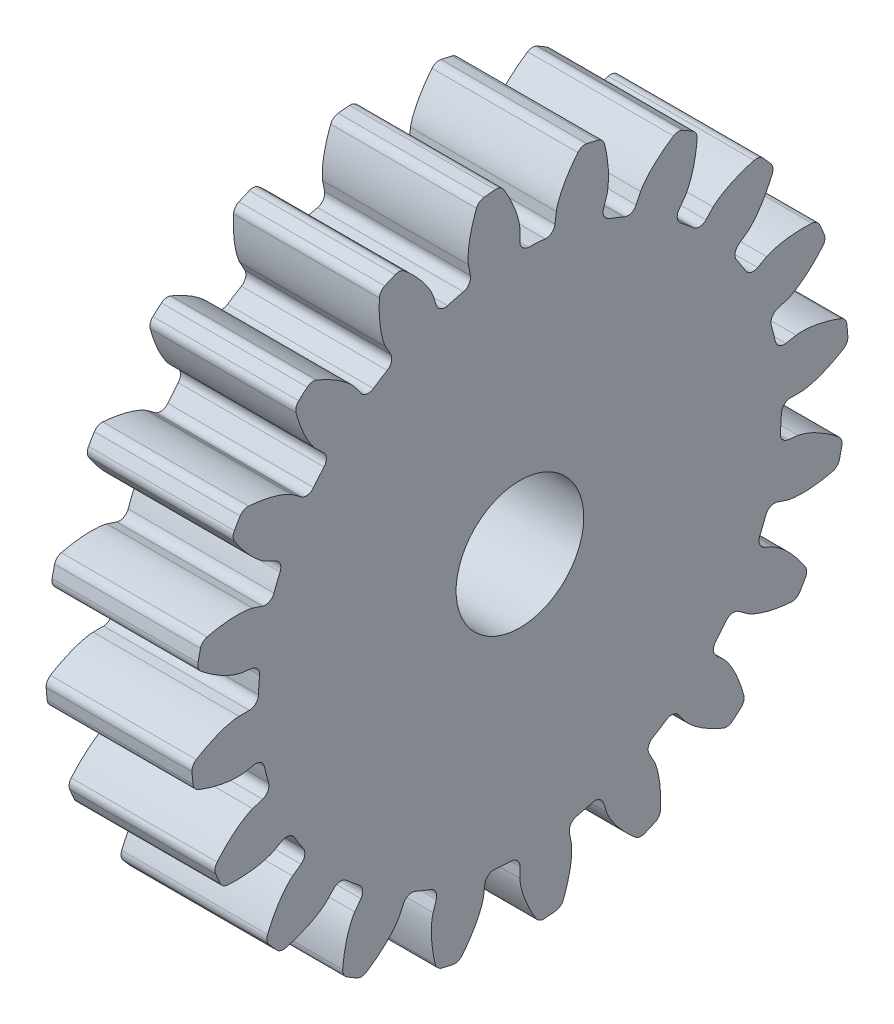
from build123d import *

# Parameters (mm, degrees)
SKETCH2_R                 = 9.02
SKETCH2_R_2               = 1.75
BOSS_EXTRUDE1_DEPTH       = 2
CUT_EXTRUDE1_DEPTH        = 14.368649894
CIRPATTERN9_COUNT         = 20
CIRPATTERN9_COPY_1_DEPTH  = 14.368649894
CIRPATTERN9_COPY_2_DEPTH  = 14.368649894
CIRPATTERN9_COPY_3_DEPTH  = 14.368649894
CIRPATTERN9_COPY_4_DEPTH  = 14.368649894
CIRPATTERN9_COPY_5_DEPTH  = 14.368649894
CIRPATTERN9_COPY_6_DEPTH  = 14.368649894
CIRPATTERN9_COPY_7_DEPTH  = 14.368649894
CIRPATTERN9_COPY_8_DEPTH  = 14.368649894
CIRPATTERN9_COPY_9_DEPTH  = 14.368649894
CIRPATTERN9_COPY_10_DEPTH = 14.368649894
CIRPATTERN9_COPY_11_DEPTH = 14.368649894
CIRPATTERN9_COPY_12_DEPTH = 14.368649894
CIRPATTERN9_COPY_13_DEPTH = 14.368649894
CIRPATTERN9_COPY_14_DEPTH = 14.368649894
CIRPATTERN9_COPY_15_DEPTH = 14.368649894
CIRPATTERN9_COPY_16_DEPTH = 14.368649894
CIRPATTERN9_COPY_17_DEPTH = 14.368649894
CIRPATTERN9_COPY_18_DEPTH = 14.368649894
CIRPATTERN9_COPY_19_DEPTH = 14.368649894
FILLET7_R                 = 0.25


with BuildPart() as part:
    # Sketch2 → Boss-Extrude1 (new, symmetric)
    with BuildSketch(Plane(origin=(0, 0, 0), x_dir=(0, -1, 0), z_dir=(1, 0, 0))):
        with Locations(Location((0, 0, 0), (0, 0, 90))):
            Circle(SKETCH2_R)
        with Locations(Location((0, 0, 0), (0, 0, 90))):
            Circle(SKETCH2_R_2, mode=Mode.SUBTRACT)
    extrude(amount=BOSS_EXTRUDE1_DEPTH, both=True)

    # Sketch3 → Cut-Extrude1 (cut, through all)
    with BuildSketch(Plane(origin=(2, 0, 0), x_dir=(0, 0, -1), z_dir=(1, 0, 0))):
        with BuildLine():
            add(Edge.make_bspline(
                [(-8.199249819, -0.110916186), (-8.226192263, -0.120506478), (-8.280187666, -0.14055911), (-8.360557059, -0.172783854), (-8.466275894, -0.219646883), (-8.57068504, -0.270055502), (-8.695529138, -0.335265376), (-8.817281381, -0.404615455), (-8.912062125, -0.463167601), (-8.981016575, -0.508033396), (-9.004780278, -0.523767261)],
                knots=[0.119851252, 0.119851252, 0.119851252, 0.119851252, 0.119851252, 0.146842495, 0.174208853, 0.201574955, 0.228941013, 0.256307345, 0.307035032, 0.333940628, 0.333940628, 0.333940628, 0.333940628, 0.333940628], degree=4))
            ThreePointArc((-8.199249819, -0.110916186), (-8.197283044, 0.211070364), (-8.182676652, 0.532731458))
            Line((-8.182676652, 0.532731458), (-9.000944317, 0.586004604))
            ThreePointArc((-9.000944317, 0.586004604), (-9.019946117, 0.031177722), (-9.004780278, -0.523767261))
        make_face()
        with BuildLine():
            Line((-7.70547949, 0), (-7.175, 0))
            ThreePointArc((-7.175, 0), (-7.171209516, 0.233193207), (-7.159842071, 0.466140026))
            Line((-7.159842071, 0.466140026), (-8.182676652, 0.532731458))
            ThreePointArc((-8.182676652, 0.532731458), (-8.197283044, 0.211070364), (-8.199249819, -0.110916186))
            add(Edge.make_bspline(
                [(-7.70547949, 0), (-7.711177451, 0), (-7.727154283, -0.000373244), (-7.757323749, -0.00255245), (-7.806393921, -0.00819623), (-7.868603495, -0.0184454), (-7.948497449, -0.035184494), (-8.041814695, -0.059365089), (-8.116007906, -0.082170078), (-8.171182976, -0.100931564), (-8.19887542, -0.110782917), (-8.199249819, -0.110916186)],
                knots=[0, 0, 0, 0, 0, 0.005376748, 0.015083688, 0.02853182, 0.046610139, 0.064854849, 0.092110525, 0.119476175, 0.119851252, 0.119851252, 0.119851252, 0.119851252, 0.119851252], degree=4))
        make_face()
    cut_extrude1 = extrude(amount=-CUT_EXTRUDE1_DEPTH, mode=Mode.SUBTRACT)

    # Mirror2: Cut-Extrude1 across plane
    add(cut_extrude1.mirror(Plane(origin=(0, 0, 0), x_dir=(0, 0.06496725101494437, 0.9978873966012204), z_dir=(0, 0.9978873966012204, -0.06496725101494437))), mode=Mode.SUBTRACT)

    # CirPattern9: Cut-Extrude1 ×20 about axis
    cirpattern9_axis = Axis((88.99, 0, 0), (-1, 0, 0))
    for i in range(1, CIRPATTERN9_COUNT):
        add(cut_extrude1.rotate(cirpattern9_axis, i * 360 / CIRPATTERN9_COUNT), mode=Mode.SUBTRACT)

    # CirPattern9 copy 1 sketch → CirPattern9 copy 1 (cut, through all)
    with BuildSketch(Plane(origin=(2, 0, 0), x_dir=(0, -0.42972242107401926, -0.90296104059161), z_dir=(1, 0, 0))):
        with BuildLine():
            add(Edge.make_bspline(
                [(-8.199249819, 0.110916186), (-8.226192263, 0.120506478), (-8.280187666, 0.14055911), (-8.360557059, 0.172783854), (-8.466275894, 0.219646883), (-8.57068504, 0.270055502), (-8.695529138, 0.335265376), (-8.817281381, 0.404615455), (-8.912062125, 0.463167601), (-8.981016575, 0.508033396), (-9.004780278, 0.523767261)],
                knots=[0.119851252, 0.119851252, 0.119851252, 0.119851252, 0.119851252, 0.146842495, 0.174208853, 0.201574955, 0.228941013, 0.256307345, 0.307035032, 0.333940628, 0.333940628, 0.333940628, 0.333940628, 0.333940628], degree=4))
            ThreePointArc((-8.199249819, 0.110916186), (-8.197283044, -0.211070364), (-8.182676652, -0.532731458))
            Line((-8.182676652, -0.532731458), (-9.000944317, -0.586004604))
            ThreePointArc((-9.000944317, -0.586004604), (-9.019946117, -0.031177722), (-9.004780278, 0.523767261))
        make_face()
        with BuildLine():
            Line((-7.70547949, 0), (-7.175, 0))
            ThreePointArc((-7.175, 0), (-7.171209516, -0.233193207), (-7.159842071, -0.466140026))
            Line((-7.159842071, -0.466140026), (-8.182676652, -0.532731458))
            ThreePointArc((-8.182676652, -0.532731458), (-8.197283044, -0.211070364), (-8.199249819, 0.110916186))
            add(Edge.make_bspline(
                [(-7.70547949, 0), (-7.711177451, 0), (-7.727154283, 0.000373244), (-7.757323749, 0.00255245), (-7.806393921, 0.00819623), (-7.868603495, 0.0184454), (-7.948497449, 0.035184494), (-8.041814695, 0.059365089), (-8.116007906, 0.082170078), (-8.171182976, 0.100931564), (-8.19887542, 0.110782917), (-8.199249819, 0.110916186)],
                knots=[0, 0, 0, 0, 0, 0.005376748, 0.015083688, 0.02853182, 0.046610139, 0.064854849, 0.092110525, 0.119476175, 0.119851252, 0.119851252, 0.119851252, 0.119851252, 0.119851252], degree=4))
        make_face()
    extrude(amount=-CIRPATTERN9_COPY_1_DEPTH, mode=Mode.SUBTRACT)

    # CirPattern9 copy 2 sketch → CirPattern9 copy 2 (cut, through all)
    with BuildSketch(Plane(origin=(2, 0, 0), x_dir=(0, -0.6877206155618701, -0.7259754506394844), z_dir=(1, 0, 0))):
        with BuildLine():
            add(Edge.make_bspline(
                [(-8.199249819, 0.110916186), (-8.226192263, 0.120506478), (-8.280187666, 0.14055911), (-8.360557059, 0.172783854), (-8.466275894, 0.219646883), (-8.57068504, 0.270055502), (-8.695529138, 0.335265376), (-8.817281381, 0.404615455), (-8.912062125, 0.463167601), (-8.981016575, 0.508033396), (-9.004780278, 0.523767261)],
                knots=[0.119851252, 0.119851252, 0.119851252, 0.119851252, 0.119851252, 0.146842495, 0.174208853, 0.201574955, 0.228941013, 0.256307345, 0.307035032, 0.333940628, 0.333940628, 0.333940628, 0.333940628, 0.333940628], degree=4))
            ThreePointArc((-8.199249819, 0.110916186), (-8.197283044, -0.211070364), (-8.182676652, -0.532731458))
            Line((-8.182676652, -0.532731458), (-9.000944317, -0.586004604))
            ThreePointArc((-9.000944317, -0.586004604), (-9.019946117, -0.031177722), (-9.004780278, 0.523767261))
        make_face()
        with BuildLine():
            Line((-7.70547949, 0), (-7.175, 0))
            ThreePointArc((-7.175, 0), (-7.171209516, -0.233193207), (-7.159842071, -0.466140026))
            Line((-7.159842071, -0.466140026), (-8.182676652, -0.532731458))
            ThreePointArc((-8.182676652, -0.532731458), (-8.197283044, -0.211070364), (-8.199249819, 0.110916186))
            add(Edge.make_bspline(
                [(-7.70547949, 0), (-7.711177451, 0), (-7.727154283, 0.000373244), (-7.757323749, 0.00255245), (-7.806393921, 0.00819623), (-7.868603495, 0.0184454), (-7.948497449, 0.035184494), (-8.041814695, 0.059365089), (-8.116007906, 0.082170078), (-8.171182976, 0.100931564), (-8.19887542, 0.110782917), (-8.199249819, 0.110916186)],
                knots=[0, 0, 0, 0, 0, 0.005376748, 0.015083688, 0.02853182, 0.046610139, 0.064854849, 0.092110525, 0.119476175, 0.119851252, 0.119851252, 0.119851252, 0.119851252, 0.119851252], degree=4))
        make_face()
    extrude(amount=-CIRPATTERN9_COPY_2_DEPTH, mode=Mode.SUBTRACT)

    # CirPattern9 copy 3 sketch → CirPattern9 copy 3 (cut, through all)
    with BuildSketch(Plane(origin=(2, 0, 0), x_dir=(0, -0.8783999245672423, -0.47792632541037444), z_dir=(1, 0, 0))):
        with BuildLine():
            add(Edge.make_bspline(
                [(-8.199249819, 0.110916186), (-8.226192263, 0.120506478), (-8.280187666, 0.14055911), (-8.360557059, 0.172783854), (-8.466275894, 0.219646883), (-8.57068504, 0.270055502), (-8.695529138, 0.335265376), (-8.817281381, 0.404615455), (-8.912062125, 0.463167601), (-8.981016575, 0.508033396), (-9.004780278, 0.523767261)],
                knots=[0.119851252, 0.119851252, 0.119851252, 0.119851252, 0.119851252, 0.146842495, 0.174208853, 0.201574955, 0.228941013, 0.256307345, 0.307035032, 0.333940628, 0.333940628, 0.333940628, 0.333940628, 0.333940628], degree=4))
            ThreePointArc((-8.199249819, 0.110916186), (-8.197283044, -0.211070364), (-8.182676652, -0.532731458))
            Line((-8.182676652, -0.532731458), (-9.000944317, -0.586004604))
            ThreePointArc((-9.000944317, -0.586004604), (-9.019946117, -0.031177722), (-9.004780278, 0.523767261))
        make_face()
        with BuildLine():
            Line((-7.70547949, 0), (-7.175, 0))
            ThreePointArc((-7.175, 0), (-7.171209516, -0.233193207), (-7.159842071, -0.466140026))
            Line((-7.159842071, -0.466140026), (-8.182676652, -0.532731458))
            ThreePointArc((-8.182676652, -0.532731458), (-8.197283044, -0.211070364), (-8.199249819, 0.110916186))
            add(Edge.make_bspline(
                [(-7.70547949, 0), (-7.711177451, 0), (-7.727154283, 0.000373244), (-7.757323749, 0.00255245), (-7.806393921, 0.00819623), (-7.868603495, 0.0184454), (-7.948497449, 0.035184494), (-8.041814695, 0.059365089), (-8.116007906, 0.082170078), (-8.171182976, 0.100931564), (-8.19887542, 0.110782917), (-8.199249819, 0.110916186)],
                knots=[0, 0, 0, 0, 0, 0.005376748, 0.015083688, 0.02853182, 0.046610139, 0.064854849, 0.092110525, 0.119476175, 0.119851252, 0.119851252, 0.119851252, 0.119851252, 0.119851252], degree=4))
        make_face()
    extrude(amount=-CIRPATTERN9_COPY_3_DEPTH, mode=Mode.SUBTRACT)

    # CirPattern9 copy 4 sketch → CirPattern9 copy 4 (cut, through all)
    with BuildSketch(Plane(origin=(2, 0, 0), x_dir=(0, -0.983095328783824, -0.1830944415415849), z_dir=(1, 0, 0))):
        with BuildLine():
            add(Edge.make_bspline(
                [(-8.199249819, 0.110916186), (-8.226192263, 0.120506478), (-8.280187666, 0.14055911), (-8.360557059, 0.172783854), (-8.466275894, 0.219646883), (-8.57068504, 0.270055502), (-8.695529138, 0.335265376), (-8.817281381, 0.404615455), (-8.912062125, 0.463167601), (-8.981016575, 0.508033396), (-9.004780278, 0.523767261)],
                knots=[0.119851252, 0.119851252, 0.119851252, 0.119851252, 0.119851252, 0.146842495, 0.174208853, 0.201574955, 0.228941013, 0.256307345, 0.307035032, 0.333940628, 0.333940628, 0.333940628, 0.333940628, 0.333940628], degree=4))
            ThreePointArc((-8.199249819, 0.110916186), (-8.197283044, -0.211070364), (-8.182676652, -0.532731458))
            Line((-8.182676652, -0.532731458), (-9.000944317, -0.586004604))
            ThreePointArc((-9.000944317, -0.586004604), (-9.019946117, -0.031177722), (-9.004780278, 0.523767261))
        make_face()
        with BuildLine():
            Line((-7.70547949, 0), (-7.175, 0))
            ThreePointArc((-7.175, 0), (-7.171209516, -0.233193207), (-7.159842071, -0.466140026))
            Line((-7.159842071, -0.466140026), (-8.182676652, -0.532731458))
            ThreePointArc((-8.182676652, -0.532731458), (-8.197283044, -0.211070364), (-8.199249819, 0.110916186))
            add(Edge.make_bspline(
                [(-7.70547949, 0), (-7.711177451, 0), (-7.727154283, 0.000373244), (-7.757323749, 0.00255245), (-7.806393921, 0.00819623), (-7.868603495, 0.0184454), (-7.948497449, 0.035184494), (-8.041814695, 0.059365089), (-8.116007906, 0.082170078), (-8.171182976, 0.100931564), (-8.19887542, 0.110782917), (-8.199249819, 0.110916186)],
                knots=[0, 0, 0, 0, 0, 0.005376748, 0.015083688, 0.02853182, 0.046610139, 0.064854849, 0.092110525, 0.119476175, 0.119851252, 0.119851252, 0.119851252, 0.119851252, 0.119851252], degree=4))
        make_face()
    extrude(amount=-CIRPATTERN9_COPY_4_DEPTH, mode=Mode.SUBTRACT)

    # CirPattern9 copy 5 sketch → CirPattern9 copy 5 (cut, through all)
    with BuildSketch(Plane(origin=(2, 0, 0), x_dir=(0, -0.9915585125911224, 0.1296600019592816), z_dir=(1, 0, 0))):
        with BuildLine():
            add(Edge.make_bspline(
                [(-8.199249819, 0.110916186), (-8.226192263, 0.120506478), (-8.280187666, 0.14055911), (-8.360557059, 0.172783854), (-8.466275894, 0.219646883), (-8.57068504, 0.270055502), (-8.695529138, 0.335265376), (-8.817281381, 0.404615455), (-8.912062125, 0.463167601), (-8.981016575, 0.508033396), (-9.004780278, 0.523767261)],
                knots=[0.119851252, 0.119851252, 0.119851252, 0.119851252, 0.119851252, 0.146842495, 0.174208853, 0.201574955, 0.228941013, 0.256307345, 0.307035032, 0.333940628, 0.333940628, 0.333940628, 0.333940628, 0.333940628], degree=4))
            ThreePointArc((-8.199249819, 0.110916186), (-8.197283044, -0.211070364), (-8.182676652, -0.532731458))
            Line((-8.182676652, -0.532731458), (-9.000944317, -0.586004604))
            ThreePointArc((-9.000944317, -0.586004604), (-9.019946117, -0.031177722), (-9.004780278, 0.523767261))
        make_face()
        with BuildLine():
            Line((-7.70547949, 0), (-7.175, 0))
            ThreePointArc((-7.175, 0), (-7.171209516, -0.233193207), (-7.159842071, -0.466140026))
            Line((-7.159842071, -0.466140026), (-8.182676652, -0.532731458))
            ThreePointArc((-8.182676652, -0.532731458), (-8.197283044, -0.211070364), (-8.199249819, 0.110916186))
            add(Edge.make_bspline(
                [(-7.70547949, 0), (-7.711177451, 0), (-7.727154283, 0.000373244), (-7.757323749, 0.00255245), (-7.806393921, 0.00819623), (-7.868603495, 0.0184454), (-7.948497449, 0.035184494), (-8.041814695, 0.059365089), (-8.116007906, 0.082170078), (-8.171182976, 0.100931564), (-8.19887542, 0.110782917), (-8.199249819, 0.110916186)],
                knots=[0, 0, 0, 0, 0, 0.005376748, 0.015083688, 0.02853182, 0.046610139, 0.064854849, 0.092110525, 0.119476175, 0.119851252, 0.119851252, 0.119851252, 0.119851252, 0.119851252], degree=4))
        make_face()
    extrude(amount=-CIRPATTERN9_COPY_5_DEPTH, mode=Mode.SUBTRACT)

    # CirPattern9 copy 6 sketch → CirPattern9 copy 6 (cut, through all)
    with BuildSketch(Plane(origin=(2, 0, 0), x_dir=(0, -0.9029610405916101, 0.4297224210740192), z_dir=(1, 0, 0))):
        with BuildLine():
            add(Edge.make_bspline(
                [(-8.199249819, 0.110916186), (-8.226192263, 0.120506478), (-8.280187666, 0.14055911), (-8.360557059, 0.172783854), (-8.466275894, 0.219646883), (-8.57068504, 0.270055502), (-8.695529138, 0.335265376), (-8.817281381, 0.404615455), (-8.912062125, 0.463167601), (-8.981016575, 0.508033396), (-9.004780278, 0.523767261)],
                knots=[0.119851252, 0.119851252, 0.119851252, 0.119851252, 0.119851252, 0.146842495, 0.174208853, 0.201574955, 0.228941013, 0.256307345, 0.307035032, 0.333940628, 0.333940628, 0.333940628, 0.333940628, 0.333940628], degree=4))
            ThreePointArc((-8.199249819, 0.110916186), (-8.197283044, -0.211070364), (-8.182676652, -0.532731458))
            Line((-8.182676652, -0.532731458), (-9.000944317, -0.586004604))
            ThreePointArc((-9.000944317, -0.586004604), (-9.019946117, -0.031177722), (-9.004780278, 0.523767261))
        make_face()
        with BuildLine():
            Line((-7.70547949, 0), (-7.175, 0))
            ThreePointArc((-7.175, 0), (-7.171209516, -0.233193207), (-7.159842071, -0.466140026))
            Line((-7.159842071, -0.466140026), (-8.182676652, -0.532731458))
            ThreePointArc((-8.182676652, -0.532731458), (-8.197283044, -0.211070364), (-8.199249819, 0.110916186))
            add(Edge.make_bspline(
                [(-7.70547949, 0), (-7.711177451, 0), (-7.727154283, 0.000373244), (-7.757323749, 0.00255245), (-7.806393921, 0.00819623), (-7.868603495, 0.0184454), (-7.948497449, 0.035184494), (-8.041814695, 0.059365089), (-8.116007906, 0.082170078), (-8.171182976, 0.100931564), (-8.19887542, 0.110782917), (-8.199249819, 0.110916186)],
                knots=[0, 0, 0, 0, 0, 0.005376748, 0.015083688, 0.02853182, 0.046610139, 0.064854849, 0.092110525, 0.119476175, 0.119851252, 0.119851252, 0.119851252, 0.119851252, 0.119851252], degree=4))
        make_face()
    extrude(amount=-CIRPATTERN9_COPY_6_DEPTH, mode=Mode.SUBTRACT)

    # CirPattern9 copy 7 sketch → CirPattern9 copy 7 (cut, through all)
    with BuildSketch(Plane(origin=(2, 0, 0), x_dir=(0, -0.7259754506394844, 0.68772061556187), z_dir=(1, 0, 0))):
        with BuildLine():
            add(Edge.make_bspline(
                [(-8.199249819, 0.110916186), (-8.226192263, 0.120506478), (-8.280187666, 0.14055911), (-8.360557059, 0.172783854), (-8.466275894, 0.219646883), (-8.57068504, 0.270055502), (-8.695529138, 0.335265376), (-8.817281381, 0.404615455), (-8.912062125, 0.463167601), (-8.981016575, 0.508033396), (-9.004780278, 0.523767261)],
                knots=[0.119851252, 0.119851252, 0.119851252, 0.119851252, 0.119851252, 0.146842495, 0.174208853, 0.201574955, 0.228941013, 0.256307345, 0.307035032, 0.333940628, 0.333940628, 0.333940628, 0.333940628, 0.333940628], degree=4))
            ThreePointArc((-8.199249819, 0.110916186), (-8.197283044, -0.211070364), (-8.182676652, -0.532731458))
            Line((-8.182676652, -0.532731458), (-9.000944317, -0.586004604))
            ThreePointArc((-9.000944317, -0.586004604), (-9.019946117, -0.031177722), (-9.004780278, 0.523767261))
        make_face()
        with BuildLine():
            Line((-7.70547949, 0), (-7.175, 0))
            ThreePointArc((-7.175, 0), (-7.171209516, -0.233193207), (-7.159842071, -0.466140026))
            Line((-7.159842071, -0.466140026), (-8.182676652, -0.532731458))
            ThreePointArc((-8.182676652, -0.532731458), (-8.197283044, -0.211070364), (-8.199249819, 0.110916186))
            add(Edge.make_bspline(
                [(-7.70547949, 0), (-7.711177451, 0), (-7.727154283, 0.000373244), (-7.757323749, 0.00255245), (-7.806393921, 0.00819623), (-7.868603495, 0.0184454), (-7.948497449, 0.035184494), (-8.041814695, 0.059365089), (-8.116007906, 0.082170078), (-8.171182976, 0.100931564), (-8.19887542, 0.110782917), (-8.199249819, 0.110916186)],
                knots=[0, 0, 0, 0, 0, 0.005376748, 0.015083688, 0.02853182, 0.046610139, 0.064854849, 0.092110525, 0.119476175, 0.119851252, 0.119851252, 0.119851252, 0.119851252, 0.119851252], degree=4))
        make_face()
    extrude(amount=-CIRPATTERN9_COPY_7_DEPTH, mode=Mode.SUBTRACT)

    # CirPattern9 copy 8 sketch → CirPattern9 copy 8 (cut, through all)
    with BuildSketch(Plane(origin=(2, 0, 0), x_dir=(0, -0.47792632541037455, 0.8783999245672421), z_dir=(1, 0, 0))):
        with BuildLine():
            add(Edge.make_bspline(
                [(-8.199249819, 0.110916186), (-8.226192263, 0.120506478), (-8.280187666, 0.14055911), (-8.360557059, 0.172783854), (-8.466275894, 0.219646883), (-8.57068504, 0.270055502), (-8.695529138, 0.335265376), (-8.817281381, 0.404615455), (-8.912062125, 0.463167601), (-8.981016575, 0.508033396), (-9.004780278, 0.523767261)],
                knots=[0.119851252, 0.119851252, 0.119851252, 0.119851252, 0.119851252, 0.146842495, 0.174208853, 0.201574955, 0.228941013, 0.256307345, 0.307035032, 0.333940628, 0.333940628, 0.333940628, 0.333940628, 0.333940628], degree=4))
            ThreePointArc((-8.199249819, 0.110916186), (-8.197283044, -0.211070364), (-8.182676652, -0.532731458))
            Line((-8.182676652, -0.532731458), (-9.000944317, -0.586004604))
            ThreePointArc((-9.000944317, -0.586004604), (-9.019946117, -0.031177722), (-9.004780278, 0.523767261))
        make_face()
        with BuildLine():
            Line((-7.70547949, 0), (-7.175, 0))
            ThreePointArc((-7.175, 0), (-7.171209516, -0.233193207), (-7.159842071, -0.466140026))
            Line((-7.159842071, -0.466140026), (-8.182676652, -0.532731458))
            ThreePointArc((-8.182676652, -0.532731458), (-8.197283044, -0.211070364), (-8.199249819, 0.110916186))
            add(Edge.make_bspline(
                [(-7.70547949, 0), (-7.711177451, 0), (-7.727154283, 0.000373244), (-7.757323749, 0.00255245), (-7.806393921, 0.00819623), (-7.868603495, 0.0184454), (-7.948497449, 0.035184494), (-8.041814695, 0.059365089), (-8.116007906, 0.082170078), (-8.171182976, 0.100931564), (-8.19887542, 0.110782917), (-8.199249819, 0.110916186)],
                knots=[0, 0, 0, 0, 0, 0.005376748, 0.015083688, 0.02853182, 0.046610139, 0.064854849, 0.092110525, 0.119476175, 0.119851252, 0.119851252, 0.119851252, 0.119851252, 0.119851252], degree=4))
        make_face()
    extrude(amount=-CIRPATTERN9_COPY_8_DEPTH, mode=Mode.SUBTRACT)

    # CirPattern9 copy 9 sketch → CirPattern9 copy 9 (cut, through all)
    with BuildSketch(Plane(origin=(2, 0, 0), x_dir=(0, -0.18309444154158497, 0.983095328783824), z_dir=(1, 0, 0))):
        with BuildLine():
            add(Edge.make_bspline(
                [(-8.199249819, 0.110916186), (-8.226192263, 0.120506478), (-8.280187666, 0.14055911), (-8.360557059, 0.172783854), (-8.466275894, 0.219646883), (-8.57068504, 0.270055502), (-8.695529138, 0.335265376), (-8.817281381, 0.404615455), (-8.912062125, 0.463167601), (-8.981016575, 0.508033396), (-9.004780278, 0.523767261)],
                knots=[0.119851252, 0.119851252, 0.119851252, 0.119851252, 0.119851252, 0.146842495, 0.174208853, 0.201574955, 0.228941013, 0.256307345, 0.307035032, 0.333940628, 0.333940628, 0.333940628, 0.333940628, 0.333940628], degree=4))
            ThreePointArc((-8.199249819, 0.110916186), (-8.197283044, -0.211070364), (-8.182676652, -0.532731458))
            Line((-8.182676652, -0.532731458), (-9.000944317, -0.586004604))
            ThreePointArc((-9.000944317, -0.586004604), (-9.019946117, -0.031177722), (-9.004780278, 0.523767261))
        make_face()
        with BuildLine():
            Line((-7.70547949, 0), (-7.175, 0))
            ThreePointArc((-7.175, 0), (-7.171209516, -0.233193207), (-7.159842071, -0.466140026))
            Line((-7.159842071, -0.466140026), (-8.182676652, -0.532731458))
            ThreePointArc((-8.182676652, -0.532731458), (-8.197283044, -0.211070364), (-8.199249819, 0.110916186))
            add(Edge.make_bspline(
                [(-7.70547949, 0), (-7.711177451, 0), (-7.727154283, 0.000373244), (-7.757323749, 0.00255245), (-7.806393921, 0.00819623), (-7.868603495, 0.0184454), (-7.948497449, 0.035184494), (-8.041814695, 0.059365089), (-8.116007906, 0.082170078), (-8.171182976, 0.100931564), (-8.19887542, 0.110782917), (-8.199249819, 0.110916186)],
                knots=[0, 0, 0, 0, 0, 0.005376748, 0.015083688, 0.02853182, 0.046610139, 0.064854849, 0.092110525, 0.119476175, 0.119851252, 0.119851252, 0.119851252, 0.119851252, 0.119851252], degree=4))
        make_face()
    extrude(amount=-CIRPATTERN9_COPY_9_DEPTH, mode=Mode.SUBTRACT)

    # CirPattern9 copy 10 sketch → CirPattern9 copy 10 (cut, through all)
    with BuildSketch(Plane(origin=(2, 0, 0), x_dir=(0, 0.12966000195928154, 0.9915585125911224), z_dir=(1, 0, 0))):
        with BuildLine():
            add(Edge.make_bspline(
                [(-8.199249819, 0.110916186), (-8.226192263, 0.120506478), (-8.280187666, 0.14055911), (-8.360557059, 0.172783854), (-8.466275894, 0.219646883), (-8.57068504, 0.270055502), (-8.695529138, 0.335265376), (-8.817281381, 0.404615455), (-8.912062125, 0.463167601), (-8.981016575, 0.508033396), (-9.004780278, 0.523767261)],
                knots=[0.119851252, 0.119851252, 0.119851252, 0.119851252, 0.119851252, 0.146842495, 0.174208853, 0.201574955, 0.228941013, 0.256307345, 0.307035032, 0.333940628, 0.333940628, 0.333940628, 0.333940628, 0.333940628], degree=4))
            ThreePointArc((-8.199249819, 0.110916186), (-8.197283044, -0.211070364), (-8.182676652, -0.532731458))
            Line((-8.182676652, -0.532731458), (-9.000944317, -0.586004604))
            ThreePointArc((-9.000944317, -0.586004604), (-9.019946117, -0.031177722), (-9.004780278, 0.523767261))
        make_face()
        with BuildLine():
            Line((-7.70547949, 0), (-7.175, 0))
            ThreePointArc((-7.175, 0), (-7.171209516, -0.233193207), (-7.159842071, -0.466140026))
            Line((-7.159842071, -0.466140026), (-8.182676652, -0.532731458))
            ThreePointArc((-8.182676652, -0.532731458), (-8.197283044, -0.211070364), (-8.199249819, 0.110916186))
            add(Edge.make_bspline(
                [(-7.70547949, 0), (-7.711177451, 0), (-7.727154283, 0.000373244), (-7.757323749, 0.00255245), (-7.806393921, 0.00819623), (-7.868603495, 0.0184454), (-7.948497449, 0.035184494), (-8.041814695, 0.059365089), (-8.116007906, 0.082170078), (-8.171182976, 0.100931564), (-8.19887542, 0.110782917), (-8.199249819, 0.110916186)],
                knots=[0, 0, 0, 0, 0, 0.005376748, 0.015083688, 0.02853182, 0.046610139, 0.064854849, 0.092110525, 0.119476175, 0.119851252, 0.119851252, 0.119851252, 0.119851252, 0.119851252], degree=4))
        make_face()
    extrude(amount=-CIRPATTERN9_COPY_10_DEPTH, mode=Mode.SUBTRACT)

    # CirPattern9 copy 11 sketch → CirPattern9 copy 11 (cut, through all)
    with BuildSketch(Plane(origin=(2, 0, 0), x_dir=(0, 0.4297224210740192, 0.9029610405916101), z_dir=(1, 0, 0))):
        with BuildLine():
            add(Edge.make_bspline(
                [(-8.199249819, 0.110916186), (-8.226192263, 0.120506478), (-8.280187666, 0.14055911), (-8.360557059, 0.172783854), (-8.466275894, 0.219646883), (-8.57068504, 0.270055502), (-8.695529138, 0.335265376), (-8.817281381, 0.404615455), (-8.912062125, 0.463167601), (-8.981016575, 0.508033396), (-9.004780278, 0.523767261)],
                knots=[0.119851252, 0.119851252, 0.119851252, 0.119851252, 0.119851252, 0.146842495, 0.174208853, 0.201574955, 0.228941013, 0.256307345, 0.307035032, 0.333940628, 0.333940628, 0.333940628, 0.333940628, 0.333940628], degree=4))
            ThreePointArc((-8.199249819, 0.110916186), (-8.197283044, -0.211070364), (-8.182676652, -0.532731458))
            Line((-8.182676652, -0.532731458), (-9.000944317, -0.586004604))
            ThreePointArc((-9.000944317, -0.586004604), (-9.019946117, -0.031177722), (-9.004780278, 0.523767261))
        make_face()
        with BuildLine():
            Line((-7.70547949, 0), (-7.175, 0))
            ThreePointArc((-7.175, 0), (-7.171209516, -0.233193207), (-7.159842071, -0.466140026))
            Line((-7.159842071, -0.466140026), (-8.182676652, -0.532731458))
            ThreePointArc((-8.182676652, -0.532731458), (-8.197283044, -0.211070364), (-8.199249819, 0.110916186))
            add(Edge.make_bspline(
                [(-7.70547949, 0), (-7.711177451, 0), (-7.727154283, 0.000373244), (-7.757323749, 0.00255245), (-7.806393921, 0.00819623), (-7.868603495, 0.0184454), (-7.948497449, 0.035184494), (-8.041814695, 0.059365089), (-8.116007906, 0.082170078), (-8.171182976, 0.100931564), (-8.19887542, 0.110782917), (-8.199249819, 0.110916186)],
                knots=[0, 0, 0, 0, 0, 0.005376748, 0.015083688, 0.02853182, 0.046610139, 0.064854849, 0.092110525, 0.119476175, 0.119851252, 0.119851252, 0.119851252, 0.119851252, 0.119851252], degree=4))
        make_face()
    extrude(amount=-CIRPATTERN9_COPY_11_DEPTH, mode=Mode.SUBTRACT)

    # CirPattern9 copy 12 sketch → CirPattern9 copy 12 (cut, through all)
    with BuildSketch(Plane(origin=(2, 0, 0), x_dir=(0, 0.68772061556187, 0.7259754506394845), z_dir=(1, 0, 0))):
        with BuildLine():
            add(Edge.make_bspline(
                [(-8.199249819, 0.110916186), (-8.226192263, 0.120506478), (-8.280187666, 0.14055911), (-8.360557059, 0.172783854), (-8.466275894, 0.219646883), (-8.57068504, 0.270055502), (-8.695529138, 0.335265376), (-8.817281381, 0.404615455), (-8.912062125, 0.463167601), (-8.981016575, 0.508033396), (-9.004780278, 0.523767261)],
                knots=[0.119851252, 0.119851252, 0.119851252, 0.119851252, 0.119851252, 0.146842495, 0.174208853, 0.201574955, 0.228941013, 0.256307345, 0.307035032, 0.333940628, 0.333940628, 0.333940628, 0.333940628, 0.333940628], degree=4))
            ThreePointArc((-8.199249819, 0.110916186), (-8.197283044, -0.211070364), (-8.182676652, -0.532731458))
            Line((-8.182676652, -0.532731458), (-9.000944317, -0.586004604))
            ThreePointArc((-9.000944317, -0.586004604), (-9.019946117, -0.031177722), (-9.004780278, 0.523767261))
        make_face()
        with BuildLine():
            Line((-7.70547949, 0), (-7.175, 0))
            ThreePointArc((-7.175, 0), (-7.171209516, -0.233193207), (-7.159842071, -0.466140026))
            Line((-7.159842071, -0.466140026), (-8.182676652, -0.532731458))
            ThreePointArc((-8.182676652, -0.532731458), (-8.197283044, -0.211070364), (-8.199249819, 0.110916186))
            add(Edge.make_bspline(
                [(-7.70547949, 0), (-7.711177451, 0), (-7.727154283, 0.000373244), (-7.757323749, 0.00255245), (-7.806393921, 0.00819623), (-7.868603495, 0.0184454), (-7.948497449, 0.035184494), (-8.041814695, 0.059365089), (-8.116007906, 0.082170078), (-8.171182976, 0.100931564), (-8.19887542, 0.110782917), (-8.199249819, 0.110916186)],
                knots=[0, 0, 0, 0, 0, 0.005376748, 0.015083688, 0.02853182, 0.046610139, 0.064854849, 0.092110525, 0.119476175, 0.119851252, 0.119851252, 0.119851252, 0.119851252, 0.119851252], degree=4))
        make_face()
    extrude(amount=-CIRPATTERN9_COPY_12_DEPTH, mode=Mode.SUBTRACT)

    # CirPattern9 copy 13 sketch → CirPattern9 copy 13 (cut, through all)
    with BuildSketch(Plane(origin=(2, 0, 0), x_dir=(0, 0.8783999245672421, 0.47792632541037455), z_dir=(1, 0, 0))):
        with BuildLine():
            add(Edge.make_bspline(
                [(-8.199249819, 0.110916186), (-8.226192263, 0.120506478), (-8.280187666, 0.14055911), (-8.360557059, 0.172783854), (-8.466275894, 0.219646883), (-8.57068504, 0.270055502), (-8.695529138, 0.335265376), (-8.817281381, 0.404615455), (-8.912062125, 0.463167601), (-8.981016575, 0.508033396), (-9.004780278, 0.523767261)],
                knots=[0.119851252, 0.119851252, 0.119851252, 0.119851252, 0.119851252, 0.146842495, 0.174208853, 0.201574955, 0.228941013, 0.256307345, 0.307035032, 0.333940628, 0.333940628, 0.333940628, 0.333940628, 0.333940628], degree=4))
            ThreePointArc((-8.199249819, 0.110916186), (-8.197283044, -0.211070364), (-8.182676652, -0.532731458))
            Line((-8.182676652, -0.532731458), (-9.000944317, -0.586004604))
            ThreePointArc((-9.000944317, -0.586004604), (-9.019946117, -0.031177722), (-9.004780278, 0.523767261))
        make_face()
        with BuildLine():
            Line((-7.70547949, 0), (-7.175, 0))
            ThreePointArc((-7.175, 0), (-7.171209516, -0.233193207), (-7.159842071, -0.466140026))
            Line((-7.159842071, -0.466140026), (-8.182676652, -0.532731458))
            ThreePointArc((-8.182676652, -0.532731458), (-8.197283044, -0.211070364), (-8.199249819, 0.110916186))
            add(Edge.make_bspline(
                [(-7.70547949, 0), (-7.711177451, 0), (-7.727154283, 0.000373244), (-7.757323749, 0.00255245), (-7.806393921, 0.00819623), (-7.868603495, 0.0184454), (-7.948497449, 0.035184494), (-8.041814695, 0.059365089), (-8.116007906, 0.082170078), (-8.171182976, 0.100931564), (-8.19887542, 0.110782917), (-8.199249819, 0.110916186)],
                knots=[0, 0, 0, 0, 0, 0.005376748, 0.015083688, 0.02853182, 0.046610139, 0.064854849, 0.092110525, 0.119476175, 0.119851252, 0.119851252, 0.119851252, 0.119851252, 0.119851252], degree=4))
        make_face()
    extrude(amount=-CIRPATTERN9_COPY_13_DEPTH, mode=Mode.SUBTRACT)

    # CirPattern9 copy 14 sketch → CirPattern9 copy 14 (cut, through all)
    with BuildSketch(Plane(origin=(2, 0, 0), x_dir=(0, 0.983095328783824, 0.18309444154158502), z_dir=(1, 0, 0))):
        with BuildLine():
            add(Edge.make_bspline(
                [(-8.199249819, 0.110916186), (-8.226192263, 0.120506478), (-8.280187666, 0.14055911), (-8.360557059, 0.172783854), (-8.466275894, 0.219646883), (-8.57068504, 0.270055502), (-8.695529138, 0.335265376), (-8.817281381, 0.404615455), (-8.912062125, 0.463167601), (-8.981016575, 0.508033396), (-9.004780278, 0.523767261)],
                knots=[0.119851252, 0.119851252, 0.119851252, 0.119851252, 0.119851252, 0.146842495, 0.174208853, 0.201574955, 0.228941013, 0.256307345, 0.307035032, 0.333940628, 0.333940628, 0.333940628, 0.333940628, 0.333940628], degree=4))
            ThreePointArc((-8.199249819, 0.110916186), (-8.197283044, -0.211070364), (-8.182676652, -0.532731458))
            Line((-8.182676652, -0.532731458), (-9.000944317, -0.586004604))
            ThreePointArc((-9.000944317, -0.586004604), (-9.019946117, -0.031177722), (-9.004780278, 0.523767261))
        make_face()
        with BuildLine():
            Line((-7.70547949, 0), (-7.175, 0))
            ThreePointArc((-7.175, 0), (-7.171209516, -0.233193207), (-7.159842071, -0.466140026))
            Line((-7.159842071, -0.466140026), (-8.182676652, -0.532731458))
            ThreePointArc((-8.182676652, -0.532731458), (-8.197283044, -0.211070364), (-8.199249819, 0.110916186))
            add(Edge.make_bspline(
                [(-7.70547949, 0), (-7.711177451, 0), (-7.727154283, 0.000373244), (-7.757323749, 0.00255245), (-7.806393921, 0.00819623), (-7.868603495, 0.0184454), (-7.948497449, 0.035184494), (-8.041814695, 0.059365089), (-8.116007906, 0.082170078), (-8.171182976, 0.100931564), (-8.19887542, 0.110782917), (-8.199249819, 0.110916186)],
                knots=[0, 0, 0, 0, 0, 0.005376748, 0.015083688, 0.02853182, 0.046610139, 0.064854849, 0.092110525, 0.119476175, 0.119851252, 0.119851252, 0.119851252, 0.119851252, 0.119851252], degree=4))
        make_face()
    extrude(amount=-CIRPATTERN9_COPY_14_DEPTH, mode=Mode.SUBTRACT)

    # CirPattern9 copy 15 sketch → CirPattern9 copy 15 (cut, through all)
    with BuildSketch(Plane(origin=(2, 0, 0), x_dir=(0, 0.9915585125911224, -0.12966000195928146), z_dir=(1, 0, 0))):
        with BuildLine():
            add(Edge.make_bspline(
                [(-8.199249819, 0.110916186), (-8.226192263, 0.120506478), (-8.280187666, 0.14055911), (-8.360557059, 0.172783854), (-8.466275894, 0.219646883), (-8.57068504, 0.270055502), (-8.695529138, 0.335265376), (-8.817281381, 0.404615455), (-8.912062125, 0.463167601), (-8.981016575, 0.508033396), (-9.004780278, 0.523767261)],
                knots=[0.119851252, 0.119851252, 0.119851252, 0.119851252, 0.119851252, 0.146842495, 0.174208853, 0.201574955, 0.228941013, 0.256307345, 0.307035032, 0.333940628, 0.333940628, 0.333940628, 0.333940628, 0.333940628], degree=4))
            ThreePointArc((-8.199249819, 0.110916186), (-8.197283044, -0.211070364), (-8.182676652, -0.532731458))
            Line((-8.182676652, -0.532731458), (-9.000944317, -0.586004604))
            ThreePointArc((-9.000944317, -0.586004604), (-9.019946117, -0.031177722), (-9.004780278, 0.523767261))
        make_face()
        with BuildLine():
            Line((-7.70547949, 0), (-7.175, 0))
            ThreePointArc((-7.175, 0), (-7.171209516, -0.233193207), (-7.159842071, -0.466140026))
            Line((-7.159842071, -0.466140026), (-8.182676652, -0.532731458))
            ThreePointArc((-8.182676652, -0.532731458), (-8.197283044, -0.211070364), (-8.199249819, 0.110916186))
            add(Edge.make_bspline(
                [(-7.70547949, 0), (-7.711177451, 0), (-7.727154283, 0.000373244), (-7.757323749, 0.00255245), (-7.806393921, 0.00819623), (-7.868603495, 0.0184454), (-7.948497449, 0.035184494), (-8.041814695, 0.059365089), (-8.116007906, 0.082170078), (-8.171182976, 0.100931564), (-8.19887542, 0.110782917), (-8.199249819, 0.110916186)],
                knots=[0, 0, 0, 0, 0, 0.005376748, 0.015083688, 0.02853182, 0.046610139, 0.064854849, 0.092110525, 0.119476175, 0.119851252, 0.119851252, 0.119851252, 0.119851252, 0.119851252], degree=4))
        make_face()
    extrude(amount=-CIRPATTERN9_COPY_15_DEPTH, mode=Mode.SUBTRACT)

    # CirPattern9 copy 16 sketch → CirPattern9 copy 16 (cut, through all)
    with BuildSketch(Plane(origin=(2, 0, 0), x_dir=(0, 0.9029610405916101, -0.42972242107401915), z_dir=(1, 0, 0))):
        with BuildLine():
            add(Edge.make_bspline(
                [(-8.199249819, 0.110916186), (-8.226192263, 0.120506478), (-8.280187666, 0.14055911), (-8.360557059, 0.172783854), (-8.466275894, 0.219646883), (-8.57068504, 0.270055502), (-8.695529138, 0.335265376), (-8.817281381, 0.404615455), (-8.912062125, 0.463167601), (-8.981016575, 0.508033396), (-9.004780278, 0.523767261)],
                knots=[0.119851252, 0.119851252, 0.119851252, 0.119851252, 0.119851252, 0.146842495, 0.174208853, 0.201574955, 0.228941013, 0.256307345, 0.307035032, 0.333940628, 0.333940628, 0.333940628, 0.333940628, 0.333940628], degree=4))
            ThreePointArc((-8.199249819, 0.110916186), (-8.197283044, -0.211070364), (-8.182676652, -0.532731458))
            Line((-8.182676652, -0.532731458), (-9.000944317, -0.586004604))
            ThreePointArc((-9.000944317, -0.586004604), (-9.019946117, -0.031177722), (-9.004780278, 0.523767261))
        make_face()
        with BuildLine():
            Line((-7.70547949, 0), (-7.175, 0))
            ThreePointArc((-7.175, 0), (-7.171209516, -0.233193207), (-7.159842071, -0.466140026))
            Line((-7.159842071, -0.466140026), (-8.182676652, -0.532731458))
            ThreePointArc((-8.182676652, -0.532731458), (-8.197283044, -0.211070364), (-8.199249819, 0.110916186))
            add(Edge.make_bspline(
                [(-7.70547949, 0), (-7.711177451, 0), (-7.727154283, 0.000373244), (-7.757323749, 0.00255245), (-7.806393921, 0.00819623), (-7.868603495, 0.0184454), (-7.948497449, 0.035184494), (-8.041814695, 0.059365089), (-8.116007906, 0.082170078), (-8.171182976, 0.100931564), (-8.19887542, 0.110782917), (-8.199249819, 0.110916186)],
                knots=[0, 0, 0, 0, 0, 0.005376748, 0.015083688, 0.02853182, 0.046610139, 0.064854849, 0.092110525, 0.119476175, 0.119851252, 0.119851252, 0.119851252, 0.119851252, 0.119851252], degree=4))
        make_face()
    extrude(amount=-CIRPATTERN9_COPY_16_DEPTH, mode=Mode.SUBTRACT)

    # CirPattern9 copy 17 sketch → CirPattern9 copy 17 (cut, through all)
    with BuildSketch(Plane(origin=(2, 0, 0), x_dir=(0, 0.7259754506394845, -0.6877206155618699), z_dir=(1, 0, 0))):
        with BuildLine():
            add(Edge.make_bspline(
                [(-8.199249819, 0.110916186), (-8.226192263, 0.120506478), (-8.280187666, 0.14055911), (-8.360557059, 0.172783854), (-8.466275894, 0.219646883), (-8.57068504, 0.270055502), (-8.695529138, 0.335265376), (-8.817281381, 0.404615455), (-8.912062125, 0.463167601), (-8.981016575, 0.508033396), (-9.004780278, 0.523767261)],
                knots=[0.119851252, 0.119851252, 0.119851252, 0.119851252, 0.119851252, 0.146842495, 0.174208853, 0.201574955, 0.228941013, 0.256307345, 0.307035032, 0.333940628, 0.333940628, 0.333940628, 0.333940628, 0.333940628], degree=4))
            ThreePointArc((-8.199249819, 0.110916186), (-8.197283044, -0.211070364), (-8.182676652, -0.532731458))
            Line((-8.182676652, -0.532731458), (-9.000944317, -0.586004604))
            ThreePointArc((-9.000944317, -0.586004604), (-9.019946117, -0.031177722), (-9.004780278, 0.523767261))
        make_face()
        with BuildLine():
            Line((-7.70547949, 0), (-7.175, 0))
            ThreePointArc((-7.175, 0), (-7.171209516, -0.233193207), (-7.159842071, -0.466140026))
            Line((-7.159842071, -0.466140026), (-8.182676652, -0.532731458))
            ThreePointArc((-8.182676652, -0.532731458), (-8.197283044, -0.211070364), (-8.199249819, 0.110916186))
            add(Edge.make_bspline(
                [(-7.70547949, 0), (-7.711177451, 0), (-7.727154283, 0.000373244), (-7.757323749, 0.00255245), (-7.806393921, 0.00819623), (-7.868603495, 0.0184454), (-7.948497449, 0.035184494), (-8.041814695, 0.059365089), (-8.116007906, 0.082170078), (-8.171182976, 0.100931564), (-8.19887542, 0.110782917), (-8.199249819, 0.110916186)],
                knots=[0, 0, 0, 0, 0, 0.005376748, 0.015083688, 0.02853182, 0.046610139, 0.064854849, 0.092110525, 0.119476175, 0.119851252, 0.119851252, 0.119851252, 0.119851252, 0.119851252], degree=4))
        make_face()
    extrude(amount=-CIRPATTERN9_COPY_17_DEPTH, mode=Mode.SUBTRACT)

    # CirPattern9 copy 18 sketch → CirPattern9 copy 18 (cut, through all)
    with BuildSketch(Plane(origin=(2, 0, 0), x_dir=(0, 0.47792632541037466, -0.8783999245672421), z_dir=(1, 0, 0))):
        with BuildLine():
            add(Edge.make_bspline(
                [(-8.199249819, 0.110916186), (-8.226192263, 0.120506478), (-8.280187666, 0.14055911), (-8.360557059, 0.172783854), (-8.466275894, 0.219646883), (-8.57068504, 0.270055502), (-8.695529138, 0.335265376), (-8.817281381, 0.404615455), (-8.912062125, 0.463167601), (-8.981016575, 0.508033396), (-9.004780278, 0.523767261)],
                knots=[0.119851252, 0.119851252, 0.119851252, 0.119851252, 0.119851252, 0.146842495, 0.174208853, 0.201574955, 0.228941013, 0.256307345, 0.307035032, 0.333940628, 0.333940628, 0.333940628, 0.333940628, 0.333940628], degree=4))
            ThreePointArc((-8.199249819, 0.110916186), (-8.197283044, -0.211070364), (-8.182676652, -0.532731458))
            Line((-8.182676652, -0.532731458), (-9.000944317, -0.586004604))
            ThreePointArc((-9.000944317, -0.586004604), (-9.019946117, -0.031177722), (-9.004780278, 0.523767261))
        make_face()
        with BuildLine():
            Line((-7.70547949, 0), (-7.175, 0))
            ThreePointArc((-7.175, 0), (-7.171209516, -0.233193207), (-7.159842071, -0.466140026))
            Line((-7.159842071, -0.466140026), (-8.182676652, -0.532731458))
            ThreePointArc((-8.182676652, -0.532731458), (-8.197283044, -0.211070364), (-8.199249819, 0.110916186))
            add(Edge.make_bspline(
                [(-7.70547949, 0), (-7.711177451, 0), (-7.727154283, 0.000373244), (-7.757323749, 0.00255245), (-7.806393921, 0.00819623), (-7.868603495, 0.0184454), (-7.948497449, 0.035184494), (-8.041814695, 0.059365089), (-8.116007906, 0.082170078), (-8.171182976, 0.100931564), (-8.19887542, 0.110782917), (-8.199249819, 0.110916186)],
                knots=[0, 0, 0, 0, 0, 0.005376748, 0.015083688, 0.02853182, 0.046610139, 0.064854849, 0.092110525, 0.119476175, 0.119851252, 0.119851252, 0.119851252, 0.119851252, 0.119851252], degree=4))
        make_face()
    extrude(amount=-CIRPATTERN9_COPY_18_DEPTH, mode=Mode.SUBTRACT)

    # CirPattern9 copy 19 sketch → CirPattern9 copy 19 (cut, through all)
    with BuildSketch(Plane(origin=(2, 0, 0), x_dir=(0, 0.18309444154158508, -0.983095328783824), z_dir=(1, 0, 0))):
        with BuildLine():
            add(Edge.make_bspline(
                [(-8.199249819, 0.110916186), (-8.226192263, 0.120506478), (-8.280187666, 0.14055911), (-8.360557059, 0.172783854), (-8.466275894, 0.219646883), (-8.57068504, 0.270055502), (-8.695529138, 0.335265376), (-8.817281381, 0.404615455), (-8.912062125, 0.463167601), (-8.981016575, 0.508033396), (-9.004780278, 0.523767261)],
                knots=[0.119851252, 0.119851252, 0.119851252, 0.119851252, 0.119851252, 0.146842495, 0.174208853, 0.201574955, 0.228941013, 0.256307345, 0.307035032, 0.333940628, 0.333940628, 0.333940628, 0.333940628, 0.333940628], degree=4))
            ThreePointArc((-8.199249819, 0.110916186), (-8.197283044, -0.211070364), (-8.182676652, -0.532731458))
            Line((-8.182676652, -0.532731458), (-9.000944317, -0.586004604))
            ThreePointArc((-9.000944317, -0.586004604), (-9.019946117, -0.031177722), (-9.004780278, 0.523767261))
        make_face()
        with BuildLine():
            Line((-7.70547949, 0), (-7.175, 0))
            ThreePointArc((-7.175, 0), (-7.171209516, -0.233193207), (-7.159842071, -0.466140026))
            Line((-7.159842071, -0.466140026), (-8.182676652, -0.532731458))
            ThreePointArc((-8.182676652, -0.532731458), (-8.197283044, -0.211070364), (-8.199249819, 0.110916186))
            add(Edge.make_bspline(
                [(-7.70547949, 0), (-7.711177451, 0), (-7.727154283, 0.000373244), (-7.757323749, 0.00255245), (-7.806393921, 0.00819623), (-7.868603495, 0.0184454), (-7.948497449, 0.035184494), (-8.041814695, 0.059365089), (-8.116007906, 0.082170078), (-8.171182976, 0.100931564), (-8.19887542, 0.110782917), (-8.199249819, 0.110916186)],
                knots=[0, 0, 0, 0, 0, 0.005376748, 0.015083688, 0.02853182, 0.046610139, 0.064854849, 0.092110525, 0.119476175, 0.119851252, 0.119851252, 0.119851252, 0.119851252, 0.119851252], degree=4))
        make_face()
    extrude(amount=-CIRPATTERN9_COPY_19_DEPTH, mode=Mode.SUBTRACT)

    # Fillet7
    fillet7_edges = [part.edges().sort_by_distance(p)[0] for p in [
        (0, 8.160120479, 3.843544427),
        (0, 6.302519459, 3.429121385),
        (0, 8.948456302, 1.133812069),
        (0, 7.053708984, 1.313702618),
        (0, 8.860854875, -1.686905715),
        (0, 7.114432328, -0.930310514),
        (0, -0.523767261, 9.004780278),
        (0, 7.905891235, -4.342497413),
        (0, 6.478745466, -3.083258371),
        (0, 0, 7.175),
        (0, 6.177043877, -6.573015209),
        (0, 5.208873858, -4.934395417),
        (0, 3.843544427, -8.160120479),
        (0, 3.429121385, -6.302519459),
        (0, 1.133812069, -8.948456302),
        (0, 1.313702618, -7.053708984),
        (0, -1.686905715, -8.860854875),
        (0, -0.930310514, -7.114432328),
        (0, -4.342497413, -7.905891235),
        (0, -3.083258371, -6.478745466),
        (0, -6.573015209, -6.177043877),
        (0, -4.934395417, -5.208873858),
        (0, -8.160120479, -3.843544427),
        (0, -6.302519459, -3.429121385),
        (0, -8.948456302, -1.133812069),
        (0, -7.053708984, -1.313702618),
        (0, -8.860854875, 1.686905715),
        (0, -7.114432328, 0.930310514),
        (0, 1.686905715, 8.860854875),
        (0, 0.930310514, 7.114432328),
        (0, -7.905891235, 4.342497413),
        (0, -6.478745466, 3.083258371),
        (0, -6.177043877, 6.573015209),
        (0, -5.208873858, 4.934395417),
        (0, -3.843544427, 8.160120479),
        (0, -3.429121385, 6.302519459),
        (0, -1.133812069, 8.948456302),
        (0, -1.313702618, 7.053708984),
        (0, -4.869140432, -7.592882947),
        (0, -4.217359185, -5.804696935),
        (0, -6.977157604, -5.716613663),
        (0, -5.804696935, -4.217359185),
        (0, 0.523767261, -9.004780278),
        (0, 0, -7.175),
        (0, -2.28449787, -8.725907946),
        (0, -2.217196935, -6.823830504),
        (0, -8.725907946, 2.28449787),
        (0, -6.823830504, 2.217196935),
        (0, -7.592882947, 4.869140432),
        (0, -5.804696935, 4.217359185),
        (0, -8.402201977, -3.280762403),
        (0, -6.823830504, -2.217196935),
        (0, -9.004780278, -0.523767261),
        (0, -7.175, 0),
        (0, 8.402201977, 3.280762403),
        (0, 6.823830504, 2.217196935),
        (0, 9.004780278, 0.523767261),
        (0, 7.175, 0),
        (0, 4.342497413, 7.905891235),
        (0, 3.083258371, 6.478745466),
        (0, 4.869140432, 7.592882947),
        (0, 4.217359185, 5.804696935),
        (0, 6.977157604, 5.716613663),
        (0, 5.804696935, 4.217359185),
        (0, 5.716613663, -6.977157604),
        (0, 4.217359185, -5.804696935),
        (0, 3.280762403, -8.402201977),
        (0, 2.217196935, -6.823830504),
        (0, 8.725907946, -2.28449787),
        (0, 6.823830504, -2.217196935),
        (0, 7.592882947, -4.869140432),
        (0, 5.804696935, -4.217359185),
        (0, -5.716613663, 6.977157604),
        (0, -4.217359185, 5.804696935),
        (0, -3.280762403, 8.402201977),
        (0, -2.217196935, 6.823830504),
        (0, 2.28449787, 8.725907946),
        (0, 2.217196935, 6.823830504),
        (0, 6.573015209, 6.177043877),
        (0, 4.934395417, 5.208873858),
    ]]
    fillet(fillet7_edges, radius=FILLET7_R)


solid = part.part
